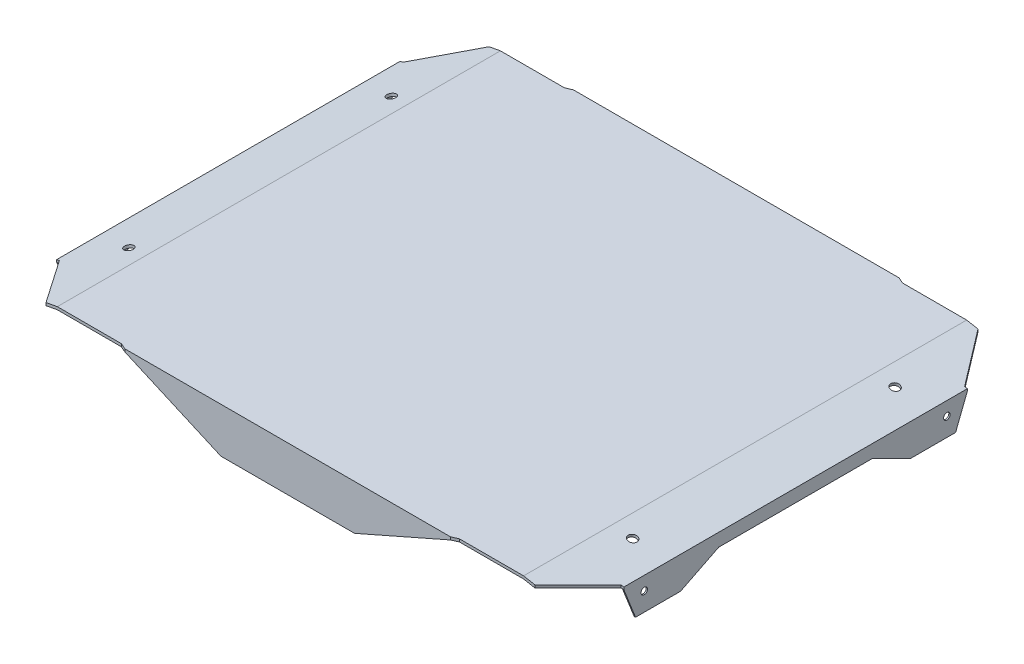
from build123d import *

# Parameters (mm, degrees)
ESQUISSE1_W                  = 416
ESQUISSE1_H                  = 329
BOSS_EXTRU_1_DEPTH           = 33
ENL_V_MAT_EXTRU_1_DEPTH      = 532.400037636
ESQUISSE3_W                  = 2
ESQUISSE3_H                  = 36.5125
ENL_V_MAT_EXTRU_2_DEPTH      = 532.400037636
ENL_V_MAT_EXTRU_3_DEPTH      = 509.456475675
ENL_V_MAT_EXTRU_3_DEPTH_BACK = 509.456475675
ENL_V_MAT_EXTRU_11_DEPTH     = 531.164125531
ENL_V_MAT_EXTRU_4_DEPTH      = 540.111732489
ENL_V_MAT_EXTRU_5_DEPTH      = 540.298629883
ESQUISSE10_W                 = 251.975
ESQUISSE10_H                 = 2.642455338
ENL_V_MAT_EXTRU_6_DEPTH      = 532.400037636
ENL_V_MAT_EXTRU_12_REACH     = 470.566
ESQUISSE18_W                 = 8
ESQUISSE18_H                 = 31
ENL_V_MAT_EXTRU_14_DEPTH     = 600
ESQUISSE20_W                 = 1
ESQUISSE20_H                 = 31
ENL_V_MAT_EXTRU_16_DEPTH     = 466.330172822
ENL_V_MAT_EXTRU_15_DEPTH     = 532.400037636
ESQUISSE21_W                 = 1
ESQUISSE21_H                 = 21.870678089
ENL_V_MAT_EXTRU_17_DEPTH     = 509.456475675
ENL_V_MAT_EXTRU_18_DEPTH     = 532.400037636
D_GAGEMENT_1_41_D            = 6.5278
D_GAGEMENT_1_42_D            = 6.5278
ENL_V_MAT_EXTRU_19_REACH     = 533.4
ESQUISSE27_R                 = 2.38125
ENL_V_MAT_EXTRU_20_REACH     = 533.4
ESQUISSE28_R                 = 2.38125


with BuildPart() as part:
    # Esquisse1 → Boss.-Extru.1 (new body)
    with BuildSketch(Plane(origin=(0, 0, 0), x_dir=(1, 0, 0), z_dir=(0, 1, 0))):
        with Locations((208, 164.5)):
            Rectangle(ESQUISSE1_W, ESQUISSE1_H)
    extrude(amount=-BOSS_EXTRU_1_DEPTH)

    # Esquisse2 → Enlèv. mat.-Extru.1 (cut, through all)
    with BuildSketch(Plane(origin=(0, 0, 0), x_dir=(1, 0, 0), z_dir=(0, 1, 0))):
        Polygon((327.417424305, 0), (332, 2), (416, 2), (416, 0), align=None)
        Polygon((88.582575695, 0), (84, 2), (0, 2), (0, 0), align=None)
        Polygon((88.582575695, 329), (84, 327), (0, 327), (0, 329), align=None)
        Polygon((327.417424305, 329), (332, 327), (416, 327), (416, 329), align=None)
    extrude(amount=-ENL_V_MAT_EXTRU_1_DEPTH, mode=Mode.SUBTRACT)

    # Esquisse3 → Enlèv. mat.-Extru.2 (cut, through all)
    with BuildSketch(Plane(origin=(0, 0, 0), x_dir=(1, 0, 0), z_dir=(0, 1, 0))):
        with Locations((415, 20.25625)):
            Rectangle(ESQUISSE3_W, ESQUISSE3_H)
        with Locations((415, 308.74375)):
            Rectangle(ESQUISSE3_W, ESQUISSE3_H)
        with Locations((1, 308.74375)):
            Rectangle(ESQUISSE3_W, ESQUISSE3_H)
        with Locations((1, 20.25625)):
            Rectangle(ESQUISSE3_W, ESQUISSE3_H)
    extrude(amount=-ENL_V_MAT_EXTRU_2_DEPTH, mode=Mode.SUBTRACT)

    # Esquisse7 → Enlèv. mat.-Extru.3 (cut, two sides: drawn at the far end of the back side and taken through both)
    with BuildSketch(Plane.XY.offset(-38.5125).offset(-ENL_V_MAT_EXTRU_3_DEPTH_BACK)):
        Polygon((416, -6.857544662), (379, 0), (416, 0), align=None)
        Polygon((0, -6.857544662), (37, 0), (0, 0), align=None)
    extrude(amount=ENL_V_MAT_EXTRU_3_DEPTH + ENL_V_MAT_EXTRU_3_DEPTH_BACK, mode=Mode.SUBTRACT)

    # Esquisse15 → Enlèv. mat.-Extru.11 (cut, through all)
    with BuildSketch(Plane(origin=(0, 0, -327), x_dir=(-1, 0, 0), z_dir=(0, 0, -1))):
        Polygon((-84, -33), (-2, -33), (-2, -8.486866573), (-37, -2), (-84, -2), align=None)
        Polygon((-414, -33), (-414, -8.486866573), (-379, -2), (-332, -2), (-332, -33), align=None)
    extrude(amount=-ENL_V_MAT_EXTRU_11_DEPTH, mode=Mode.SUBTRACT)

    # Esquisse8 → Enlèv. mat.-Extru.4 (cut, through all, along a direction that is not the sketch's normal)
    with BuildSketch(Plane(origin=(1.22876211, -6.629807067, 0), x_dir=(0.9832549075639557, 0.1822355254921413, 0), z_dir=(-0.1822355254921413, 0.9832549075639557, 0))):
        Polygon((0.784372276, 38.5125), (27.933724824, 2), (0.784372276, 2), align=None)
        Polygon((0.784372276, 290.4875), (27.933724824, 327), (0.784372276, 327), align=None)
    extrude(amount=-ENL_V_MAT_EXTRU_4_DEPTH, dir=(0, 1, 0), mode=Mode.SUBTRACT)

    # Esquisse9 → Enlèv. mat.-Extru.5 (cut, through all, along a direction that is not the sketch's normal)
    with BuildSketch(Plane(origin=(12.586509179, 67.910726439, 0), x_dir=(0.9832549075639558, -0.18223552549214084, 0), z_dir=(0.18223552549214084, 0.9832549075639558, 0))):
        Polygon((408.24966927, 290.4875), (381.100316723, 327), (408.24966927, 327), align=None)
        Polygon((408.24966927, 38.5125), (381.100316723, 2), (408.24966927, 2), align=None)
    extrude(amount=-ENL_V_MAT_EXTRU_5_DEPTH, dir=(0, 1, 0), mode=Mode.SUBTRACT)

    # Esquisse10 → Enlèv. mat.-Extru.6 (cut, through all)
    with BuildSketch(Plane(origin=(416, 0, 0), x_dir=(0, 0, -1), z_dir=(1, 0, 0))):
        with Locations((164.5, -31.678772331)):
            Rectangle(ESQUISSE10_W, ESQUISSE10_H)
    extrude(amount=-ENL_V_MAT_EXTRU_6_DEPTH, mode=Mode.SUBTRACT)

    # Esquisse16 → Enlèv. mat.-Extru.12 (cut, up to next)
    with BuildSketch(Plane.ZY.offset(-84), mode=Mode.PRIVATE) as enl_v_mat_extru_12_sk1:
        Polygon((-290.4875, -30.357544662), (-290.4875, -33), (-327, -33), (-327, -2), (-2, -2), (-2, -33), (-38.5125, -33), (-38.5125, -30.357544662), align=None)
    enl_v_mat_extru_12_tool1 = extrude(enl_v_mat_extru_12_sk1.sketch, amount=-ENL_V_MAT_EXTRU_12_REACH, mode=Mode.PRIVATE) & part.part
    add(enl_v_mat_extru_12_tool1.solids().sort_by_distance((84, -16.49665, -164.5))[0], mode=Mode.SUBTRACT)

    # Esquisse18 → Enlèv. mat.-Extru.14 (cut)
    with BuildSketch(Plane.XY):
        with Locations((331.417424305, -17.5)):
            Rectangle(ESQUISSE18_W, ESQUISSE18_H)
        with Locations((84.582575695, -17.5)):
            Rectangle(ESQUISSE18_W, ESQUISSE18_H)
    extrude(amount=-ENL_V_MAT_EXTRU_14_DEPTH, mode=Mode.SUBTRACT)

    # Esquisse20 → Enlèv. mat.-Extru.16 (cut, through all)
    with BuildSketch(Plane(origin=(327.417424305, 0, 0), x_dir=(0, 0, -1), z_dir=(1, 0, 0))):
        with Locations((1.5, -17.5)):
            Rectangle(ESQUISSE20_W, ESQUISSE20_H)
        with Locations((327.5, -17.5)):
            Rectangle(ESQUISSE20_W, ESQUISSE20_H)
    extrude(amount=-ENL_V_MAT_EXTRU_16_DEPTH, mode=Mode.SUBTRACT)

    # Esquisse19 → Enlèv. mat.-Extru.15 (cut, through all)
    with BuildSketch(Plane.XY):
        Polygon((88.582575695, -2), (158.997575695, -33), (88.582575695, -33), align=None)
        Polygon((327.417424305, -2), (256.997575695, -33), (327.417424305, -33), align=None)
    extrude(amount=-ENL_V_MAT_EXTRU_15_DEPTH, mode=Mode.SUBTRACT)

    # Esquisse21 → Enlèv. mat.-Extru.17 (cut, through all)
    with BuildSketch(Plane(origin=(0, 0, -290.4875), x_dir=(-1, 0, 0), z_dir=(0, 0, -1))):
        with Locations((-414.5, -19.422205618)):
            Rectangle(ESQUISSE21_W, ESQUISSE21_H)
        with Locations((-1.5, -19.422205618)):
            Rectangle(ESQUISSE21_W, ESQUISSE21_H)
    extrude(amount=-ENL_V_MAT_EXTRU_17_DEPTH, mode=Mode.SUBTRACT)

    # Esquisse22 → Enlèv. mat.-Extru.18 (cut, through all)
    with BuildSketch(Plane(origin=(416, 0, 0), x_dir=(0, 0, -1), z_dir=(1, 0, 0))):
        Polygon((38.5125, -8.486866573), (47.110374149, -30.357544662), (38.5125, -30.357544662), align=None)
        Polygon((290.4875, -8.486866573), (281.889625851, -30.357544662), (290.4875, -30.357544662), align=None)
        Polygon((80.110374149, -30.357544662), (108.145374149, -16.357544662), (220.645374149, -16.357544662), (248.889625851, -30.357544662), align=None)
    extrude(amount=-ENL_V_MAT_EXTRU_18_DEPTH, mode=Mode.SUBTRACT)

    # Dégagement 1/41 (through all)
    with Locations(Plane(origin=(12.586509179, 67.910726439, 0), x_dir=(0.9832549075639558, -0.18223552549214084, 0), z_dir=(0.18223552549214084, 0.9832549075639558, 0))):
        with Locations((386.653609967, 68.25), (386.653609967, 260.75)):
            Hole(D_GAGEMENT_1_41_D / 2)

    # Dégagement 1/42 (through all)
    with Locations(Plane(origin=(1.22876211, -6.629807067, 0), x_dir=(0.9832549075639557, 0.18223552549214128, 0), z_dir=(-0.1822355254921413, 0.9832549075639558, 0))):
        with Locations((22.38043158, 68.25), (22.38043158, 260.75)):
            Hole(D_GAGEMENT_1_42_D / 2)

    # Esquisse27 → Enlèv. mat.-Extru.19 (cut, up to next)
    with BuildSketch(Plane.ZY, mode=Mode.PRIVATE) as enl_v_mat_extru_19_sk1:
        with Locations((-275.4875, -16.857544662)):
            Circle(ESQUISSE27_R)
    enl_v_mat_extru_19_tool1 = extrude(enl_v_mat_extru_19_sk1.sketch, amount=-ENL_V_MAT_EXTRU_19_REACH, mode=Mode.PRIVATE) & part.part
    # Esquisse27 → Enlèv. mat.-Extru.19 (cut, up to next)
    with BuildSketch(Plane.ZY, mode=Mode.PRIVATE) as enl_v_mat_extru_19_sk2:
        with Locations((-53.5125, -16.857544662)):
            Circle(ESQUISSE27_R)
    enl_v_mat_extru_19_tool2 = extrude(enl_v_mat_extru_19_sk2.sketch, amount=-ENL_V_MAT_EXTRU_19_REACH, mode=Mode.PRIVATE) & part.part
    add(enl_v_mat_extru_19_tool1.solids().sort_by_distance((0, -16.857545, -275.4875))[0], mode=Mode.SUBTRACT)
    add(enl_v_mat_extru_19_tool2.solids().sort_by_distance((0, -16.857545, -53.5125))[0], mode=Mode.SUBTRACT)

    # Esquisse28 → Enlèv. mat.-Extru.20 (cut, up to next)
    with BuildSketch(Plane(origin=(416, 0, 0), x_dir=(0, 0, -1), z_dir=(1, 0, 0)), mode=Mode.PRIVATE) as enl_v_mat_extru_20_sk1:
        with Locations(Location((53.5125, -16.857544662, 0), (0, 0, 180))):
            Circle(ESQUISSE28_R)
    enl_v_mat_extru_20_tool1 = extrude(enl_v_mat_extru_20_sk1.sketch, amount=-ENL_V_MAT_EXTRU_20_REACH, mode=Mode.PRIVATE) & part.part
    # Esquisse28 → Enlèv. mat.-Extru.20 (cut, up to next)
    with BuildSketch(Plane(origin=(416, 0, 0), x_dir=(0, 0, -1), z_dir=(1, 0, 0)), mode=Mode.PRIVATE) as enl_v_mat_extru_20_sk2:
        with Locations(Location((275.4875, -16.857544662, 0), (0, 0, 180))):
            Circle(ESQUISSE28_R)
    enl_v_mat_extru_20_tool2 = extrude(enl_v_mat_extru_20_sk2.sketch, amount=-ENL_V_MAT_EXTRU_20_REACH, mode=Mode.PRIVATE) & part.part
    add(enl_v_mat_extru_20_tool1.solids().sort_by_distance((416, -16.857545, -53.5125))[0], mode=Mode.SUBTRACT)
    add(enl_v_mat_extru_20_tool2.solids().sort_by_distance((416, -16.857545, -275.4875))[0], mode=Mode.SUBTRACT)


solid = part.part
